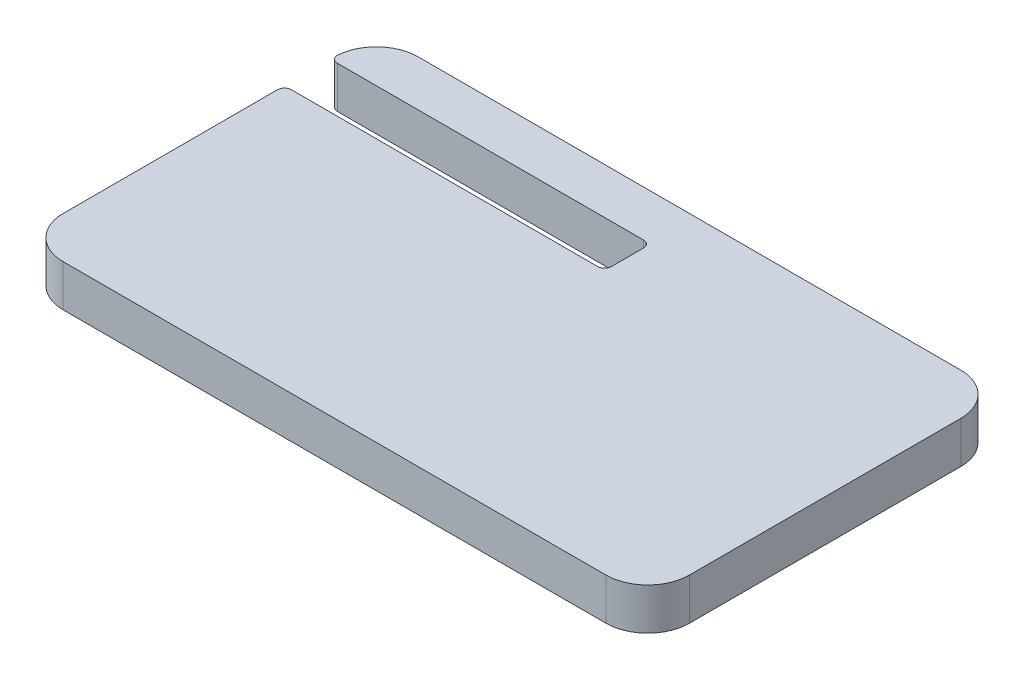
from build123d import *

# Parameters (mm, degrees)
CROQUIS1_W              = 45
CROQUIS1_H              = 25.5
SALIENTE_EXTRUIR1_DEPTH = 3
CROQUIS2_W              = 23
CROQUIS2_H              = 3.3
CORTAR_EXTRUIR1_DEPTH   = 3
REDONDEO1_R             = 3
REDONDEO4_R             = 0.5


with BuildPart() as part:
    # Croquis1 → Saliente-Extruir1 (new body)
    with BuildSketch(Plane(origin=(0, 0, 0), x_dir=(1, 0, 0), z_dir=(0, 1, 0))):
        with Locations((0, -2.820152791)):
            Rectangle(CROQUIS1_W, CROQUIS1_H)
    extrude(amount=SALIENTE_EXTRUIR1_DEPTH)

    # Croquis2 → Cortar-Extruir1 (cut)
    with BuildSketch(Plane(origin=(0, 3, 0), x_dir=(1, 0, 0), z_dir=(0, 1, 0))):
        with Locations((-11, 4.979847209)):
            Rectangle(CROQUIS2_W, CROQUIS2_H)
    extrude(amount=-CORTAR_EXTRUIR1_DEPTH, mode=Mode.SUBTRACT)

    # Redondeo1
    redondeo1_edges = [part.edges().sort_by_distance(p)[0] for p in [
        (-22.5, 1.5, -9.929847209),
        (22.5, 1.5, -9.929847209),
        (22.5, 1.5, 15.570152791),
        (-22.5, 1.5, 15.570152791),
    ]]
    fillet(redondeo1_edges, radius=REDONDEO1_R)

    # Redondeo4
    redondeo4_edges = [part.edges().sort_by_distance(p)[0] for p in [
        (-22.5, 1.5, -3.329847209),
        (0.5, 1.5, -3.329847209),
        (0.5, 1.5, -6.629847209),
        (-22.5, 1.5, -6.629847209),
    ]]
    fillet(redondeo4_edges, radius=REDONDEO4_R)


solid = part.part
